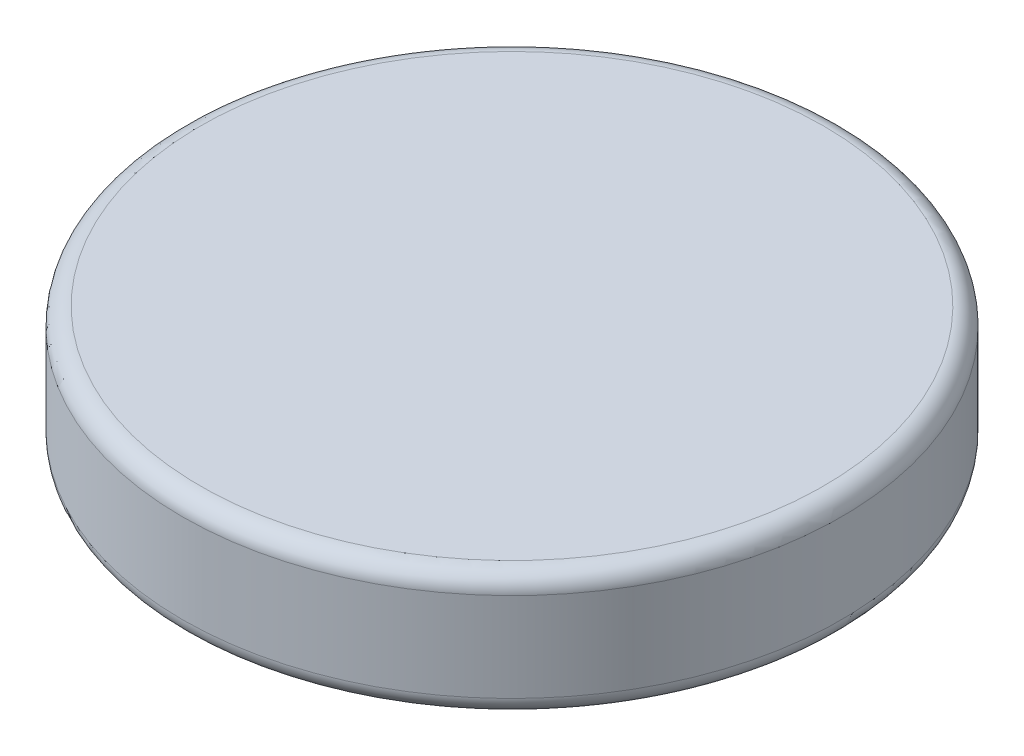
from build123d import *

# Parameters (mm, degrees)
SKETCH3_R          = 4.141637382
CUT_EXTRUDE1_DEPTH = 7
FILLET2_R          = 1
FILLET3_R          = 1


with BuildPart() as part:
    # Sketch2 → Revolve1 (revolve)
    with BuildSketch(Plane.XY, mode=Mode.PRIVATE) as revolve1_sk:
        with BuildLine():
            Line((1.5, 1.5), (1.5, 3.5))
            ThreePointArc((1.5, 3.5), (1.207106781, 4.207106781), (0.5, 4.5))
            Line((0.5, 4.5), (-9.5, 4.5))
            Line((-9.5, 4.5), (-9.5, 11.5))
            Line((-9.5, 11.5), (9, 11.5))
            Line((9, 11.5), (9, 1.5))
            Line((9, 1.5), (1.5, 1.5))
        make_face()
    revolve(revolve1_sk.sketch.rotate(Axis((9, 1.5, 0), (0, 1, 0)), 270), axis=Axis((9, 1.5, 0), (0, 1, 0)))

    # Sketch3 → Cut-Extrude1 (cut)
    with BuildSketch(Plane.XZ.offset(-1.5)):
        with Locations((9, 0)):
            Circle(SKETCH3_R)
    extrude(amount=-CUT_EXTRUDE1_DEPTH, mode=Mode.SUBTRACT)

    # Fillet2
    fillet2_edges = [part.edges().sort_by_distance(p)[0] for p in [
        (9, 4.5, 18.5),
        (9, 11.5, 18.5),
    ]]
    fillet(fillet2_edges, radius=FILLET2_R)

    # Fillet3
    fillet3_edges = [part.edges().sort_by_distance(p)[0] for p in [
        (9, 1.5, 7.5),
    ]]
    fillet(fillet3_edges, radius=FILLET3_R)


solid = part.part
